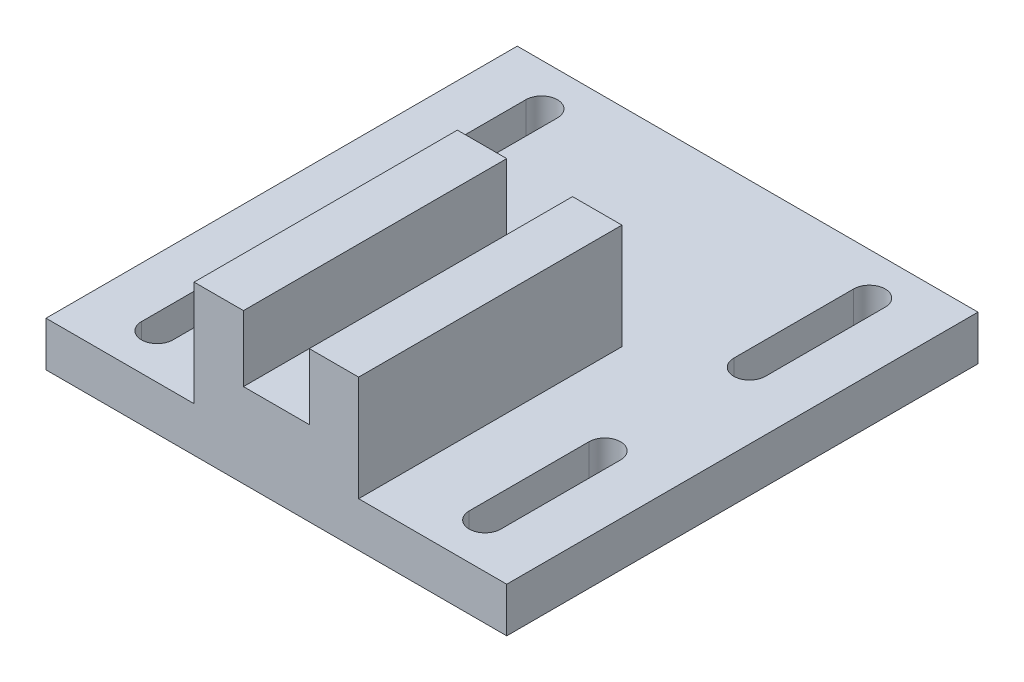
from build123d import *

# Parameters (mm, degrees)
SKETCH1_W               = 15.875
SKETCH1_H               = 25.4
BOSS_EXTRUDE1_DEPTH     = 4.318
BOSS_EXTRUDE2_START     = 4.318
SKETCH1_3_W             = 15.875
SKETCH1_3_H             = 25.4
BOSS_EXTRUDE2_DEPTH     = 10.16
CUT_EXTRUDE1_DEPTH      = 66.211748481
CUT_EXTRUDE1_DEPTH_BACK = 66.211748481
SKETCH2_W               = 6.35
SKETCH2_H               = 6.35


with BuildPart() as part:
    # Sketch1 → Boss-Extrude1 (new body)
    # profile 1 of 2: a face of its own
    with BuildSketch(Plane(origin=(0, 0, 0), x_dir=(1, 0, 0), z_dir=(0, 1, 0))):
        Polygon((44.45, 0), (0, 0), (0, -45.466), (14.2875, -45.466), (14.2875, -20.066), (30.1625, -20.066), (30.1625, -45.466), (44.45, -45.466), align=None)
        with BuildLine():
            ThreePointArc((4.8895, -29.591), (6.4135, -28.067), (7.9375, -29.591))
            Line((7.9375, -29.591), (7.9375, -41.148))
            ThreePointArc((7.9375, -41.148), (6.4135, -42.672), (4.8895, -41.148))
            Line((4.8895, -41.148), (4.8895, -29.591))
        make_face(mode=Mode.SUBTRACT)
        with BuildLine():
            ThreePointArc((36.5125, -29.591), (38.0365, -28.067), (39.5605, -29.591))
            Line((39.5605, -29.591), (39.5605, -41.148))
            ThreePointArc((39.5605, -41.148), (38.0365, -42.672), (36.5125, -41.148))
            Line((36.5125, -41.148), (36.5125, -29.591))
        make_face(mode=Mode.SUBTRACT)
        with BuildLine():
            ThreePointArc((4.8895, -4.064), (6.4135, -2.54), (7.9375, -4.064))
            Line((7.9375, -4.064), (7.9375, -15.621))
            ThreePointArc((7.9375, -15.621), (6.4135, -17.145), (4.8895, -15.621))
            Line((4.8895, -15.621), (4.8895, -4.064))
        make_face(mode=Mode.SUBTRACT)
        with BuildLine():
            ThreePointArc((36.5125, -4.064), (38.0365, -2.54), (39.5605, -4.064))
            Line((39.5605, -4.064), (39.5605, -15.621))
            ThreePointArc((39.5605, -15.621), (38.0365, -17.145), (36.5125, -15.621))
            Line((36.5125, -15.621), (36.5125, -4.064))
        make_face(mode=Mode.SUBTRACT)
    # profile 2 of 2: a face of its own
    with BuildSketch(Plane(origin=(0, 0, 0), x_dir=(1, 0, 0), z_dir=(0, 1, 0))):
        with Locations((22.225, -32.766)):
            Rectangle(SKETCH1_W, SKETCH1_H)
    extrude(amount=BOSS_EXTRUDE1_DEPTH)

    # Sketch1<3> → Boss-Extrude2 (add)
    with BuildSketch(Plane(origin=(0, 0, 0), x_dir=(1, 0, 0), z_dir=(0, 1, 0)).offset(BOSS_EXTRUDE2_START)):
        with Locations((22.225, -32.766)):
            Rectangle(SKETCH1_3_W, SKETCH1_3_H)
    extrude(amount=BOSS_EXTRUDE2_DEPTH)

    # Sketch2 → Cut-Extrude1 (cut, two sides: drawn at the far end of the back side and taken through both)
    with BuildSketch(Plane.XY.offset(45.466).offset(-CUT_EXTRUDE1_DEPTH_BACK)):
        with Locations((22.225, 11.303)):
            Rectangle(SKETCH2_W, SKETCH2_H)
    extrude(amount=CUT_EXTRUDE1_DEPTH + CUT_EXTRUDE1_DEPTH_BACK, mode=Mode.SUBTRACT)


solid = part.part
